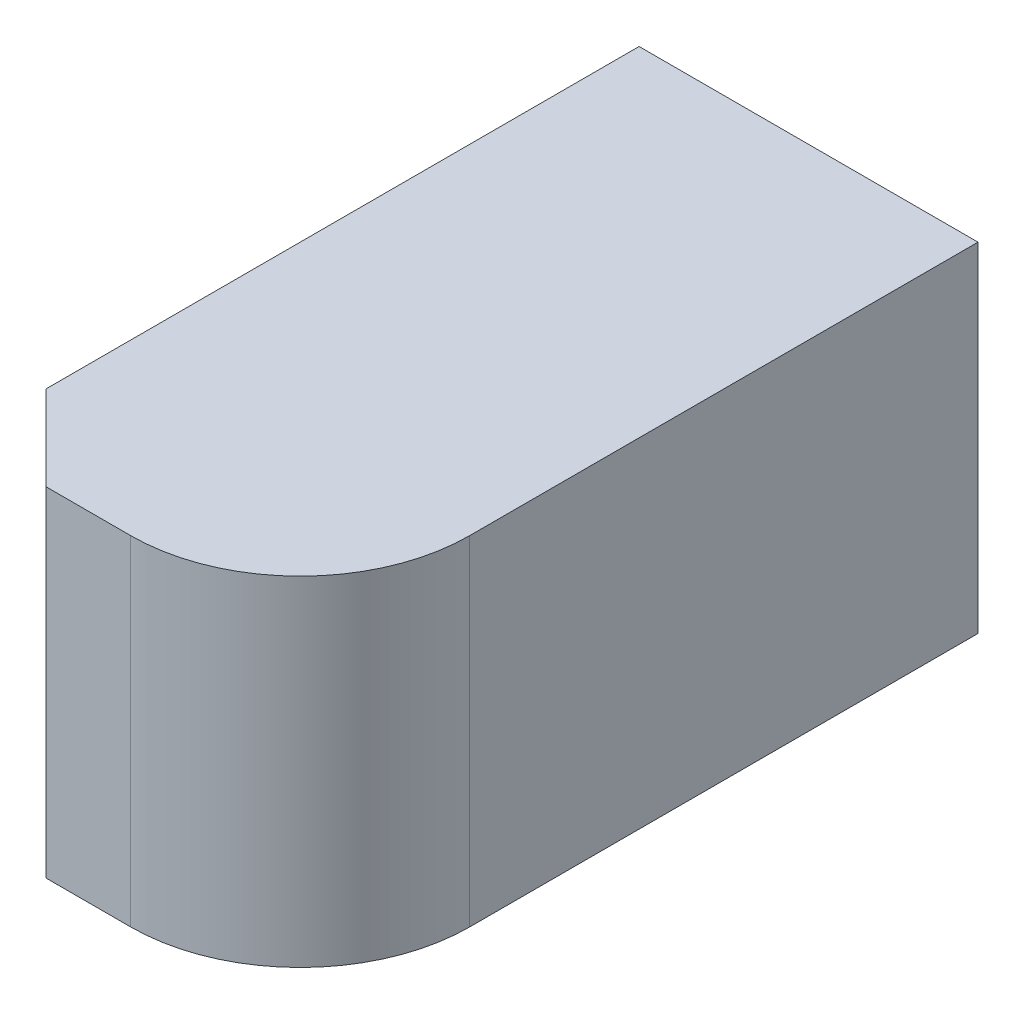
from build123d import *

# Parameters (mm, degrees)
SKETCH2_W           = 20
SKETCH2_H           = 40
BOSS_EXTRUDE1_DEPTH = 20
FILLET1_R           = 10
CHAMFER1_SIZE       = 5


with BuildPart() as part:
    # Sketch2 → Boss-Extrude1 (new body)
    with BuildSketch(Plane(origin=(0, 0, 0), x_dir=(1, 0, 0), z_dir=(0, 1, 0))):
        with Locations((10, 20)):
            Rectangle(SKETCH2_W, SKETCH2_H)
    extrude(amount=BOSS_EXTRUDE1_DEPTH)

    # Fillet1
    fillet1_edges = [part.edges().sort_by_distance(p)[0] for p in [
        (20, 10, 0),
    ]]
    fillet(fillet1_edges, radius=FILLET1_R)

    # Chamfer1
    chamfer1_edges = [part.edges().sort_by_distance(p)[0] for p in [
        (0, 10, 0),
    ]]
    chamfer(chamfer1_edges, length=CHAMFER1_SIZE)


solid = part.part
